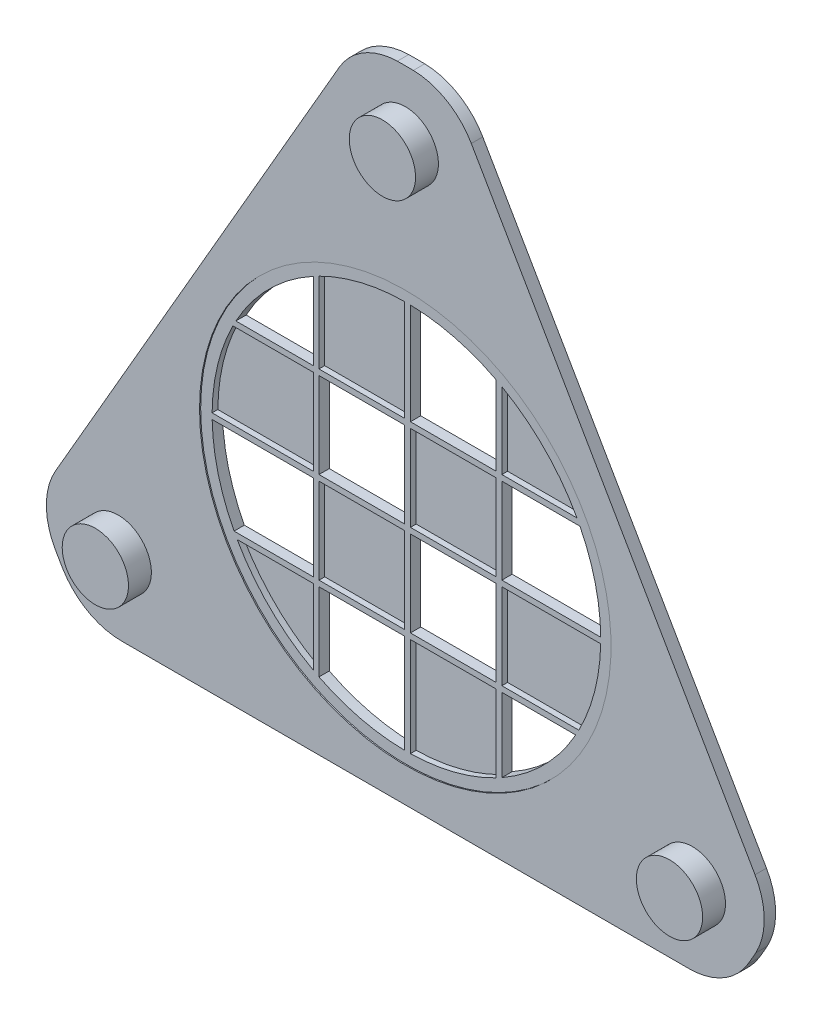
from build123d import *

# Parameters (mm, degrees)
SKETCH2_R               = 18
SKETCH2_W               = 7.5
SKETCH2_H               = 7.5
BOSS_EXTRUDE1_DEPTH     = 0.9
BOSS_EXTRUDE10_START    = 0.4
SKETCH18_W              = 7.7
SKETCH18_H              = 7.7
BOSS_EXTRUDE10_DEPTH    = 0.4
BOSS_EXTRUDE2_START     = -1
SKETCH3_R               = 35
SKETCH3_R_2             = 18
BOSS_EXTRUDE2_DEPTH     = 1
SKETCH4_R               = 2.9
BOSS_EXTRUDE3_DEPTH     = 3
CUT_EXTRUDE1_DEPTH      = 50.588305073
CUT_EXTRUDE1_DEPTH_BACK = 50.588305073
SKETCH7_R               = 59.131365533
FILLET1_R               = 6


with BuildPart() as part:
    # Sketch2 → Boss-Extrude1 (new body)
    with BuildSketch(Plane.XY.offset(10)):
        Circle(SKETCH2_R)
        with BuildLine():
            Line((-8.15, -8.35), (-8.15, -14.91903147))
            ThreePointArc((-8.15, -14.91903147), (-11.939670478, -12.101415986), (-14.808021475, -8.35))
            Line((-14.808021475, -8.35), (-8.15, -8.35))
        make_face(mode=Mode.SUBTRACT)
        with BuildLine():
            Line((-8.15, -7.85), (-15.079041747, -7.85))
            ThreePointArc((-15.079041747, -7.85), (-16.470304718, -4.210589327), (-16.996396677, -0.35))
            Line((-16.996396677, -0.35), (-8.15, -0.35))
            Line((-8.15, -0.35), (-8.15, -7.85))
        make_face(mode=Mode.SUBTRACT)
        with BuildLine():
            Line((-8.15, 0.15), (-16.999338222, 0.15))
            ThreePointArc((-16.999338222, 0.15), (-16.521617742, 4.00451585), (-15.181485435, 7.65))
            Line((-15.181485435, 7.65), (-8.15, 7.65))
            Line((-8.15, 7.65), (-8.15, 0.15))
        make_face(mode=Mode.SUBTRACT)
        with BuildLine():
            Line((-8.15, 8.15), (-14.91903147, 8.15))
            ThreePointArc((-14.91903147, 8.15), (-12.02081528, 12.02081528), (-8.15, 14.91903147))
            Line((-8.15, 14.91903147), (-8.15, 8.15))
        make_face(mode=Mode.SUBTRACT)
        with BuildLine():
            Line((-7.65, 8.15), (-7.65, 15.181485435))
            ThreePointArc((-7.65, 15.181485435), (-4.00451585, 16.521617742), (-0.15, 16.999338222))
            Line((-0.15, 16.999338222), (-0.15, 8.15))
            Line((-0.15, 8.15), (-7.65, 8.15))
        make_face(mode=Mode.SUBTRACT)
        with BuildLine():
            Line((0.35, 8.15), (0.35, 16.996396677))
            ThreePointArc((0.35, 16.996396677), (4.210589327, 16.470304718), (7.85, 15.079041747))
            Line((7.85, 15.079041747), (7.85, 8.15))
            Line((7.85, 8.15), (0.35, 8.15))
        make_face(mode=Mode.SUBTRACT)
        with BuildLine():
            Line((8.35, 8.15), (8.35, 14.808021475))
            ThreePointArc((8.35, 14.808021475), (12.101415986, 11.939670478), (14.91903147, 8.15))
            Line((14.91903147, 8.15), (8.35, 8.15))
        make_face(mode=Mode.SUBTRACT)
        with BuildLine():
            Line((8.35, 7.65), (15.181485435, 7.65))
            ThreePointArc((15.181485435, 7.65), (16.521617742, 4.00451585), (16.999338222, 0.15))
            Line((16.999338222, 0.15), (8.35, 0.15))
            Line((8.35, 0.15), (8.35, 7.65))
        make_face(mode=Mode.SUBTRACT)
        with BuildLine():
            Line((8.35, -0.35), (16.996396677, -0.35))
            ThreePointArc((16.996396677, -0.35), (16.470304718, -4.210589327), (15.079041747, -7.85))
            Line((15.079041747, -7.85), (8.35, -7.85))
            Line((8.35, -7.85), (8.35, -0.35))
        make_face(mode=Mode.SUBTRACT)
        with BuildLine():
            Line((8.35, -8.35), (14.808021475, -8.35))
            ThreePointArc((14.808021475, -8.35), (12.02081528, -12.02081528), (8.35, -14.808021475))
            Line((8.35, -14.808021475), (8.35, -8.35))
        make_face(mode=Mode.SUBTRACT)
        with BuildLine():
            Line((7.85, -8.35), (7.85, -15.079041747))
            ThreePointArc((7.85, -15.079041747), (4.210589327, -16.470304718), (0.35, -16.996396677))
            Line((0.35, -16.996396677), (0.35, -8.35))
            Line((0.35, -8.35), (7.85, -8.35))
        make_face(mode=Mode.SUBTRACT)
        with BuildLine():
            Line((-0.15, -8.35), (-0.15, -16.999338222))
            ThreePointArc((-0.15, -16.999338222), (-4.00451585, -16.521617742), (-7.65, -15.181485435))
            Line((-7.65, -15.181485435), (-7.65, -8.35))
            Line((-7.65, -8.35), (-0.15, -8.35))
        make_face(mode=Mode.SUBTRACT)
        with Locations((-3.9, -4.1)):
            Rectangle(SKETCH2_W, SKETCH2_H, mode=Mode.SUBTRACT)
        with Locations((4.1, -4.1)):
            Rectangle(SKETCH2_W, SKETCH2_H, mode=Mode.SUBTRACT)
        with Locations((-3.9, 3.9)):
            Rectangle(SKETCH2_W, SKETCH2_H, mode=Mode.SUBTRACT)
        with Locations((4.1, 3.9)):
            Rectangle(SKETCH2_W, SKETCH2_H, mode=Mode.SUBTRACT)
    extrude(amount=-BOSS_EXTRUDE1_DEPTH)

    # Sketch18 → Boss-Extrude10 (add)
    with BuildSketch(Plane.XY.offset(9.1).offset(BOSS_EXTRUDE10_START)):
        with BuildLine():
            ThreePointArc((-0.15, 16.999338222), (-4.11362184, 16.494790552), (-7.85, 15.079041747))
            Line((-7.85, 15.079041747), (-7.85, 8.15))
            Line((-7.85, 8.15), (-0.15, 8.15))
            Line((-0.15, 8.15), (-0.15, 16.999338222))
        make_face()
        with Locations((4, 4)):
            Rectangle(SKETCH18_W, SKETCH18_H)
        with Locations((-4, -4)):
            Rectangle(SKETCH18_W, SKETCH18_H)
        with BuildLine():
            Line((8.15, 8.15), (14.91903147, 8.15))
            ThreePointArc((14.91903147, 8.15), (12.02081528, 12.02081528), (8.15, 14.91903147))
            Line((8.15, 14.91903147), (8.15, 8.15))
        make_face()
        with BuildLine():
            ThreePointArc((-15.079041747, 7.85), (-16.494790552, 4.11362184), (-16.999338222, 0.15))
            Line((-16.999338222, 0.15), (-8.15, 0.15))
            Line((-8.15, 0.15), (-8.15, 7.85))
            Line((-8.15, 7.85), (-15.079041747, 7.85))
        make_face()
        with BuildLine():
            Line((0.15, -8.15), (0.15, -16.999338222))
            ThreePointArc((0.15, -16.999338222), (4.11362184, -16.494790552), (7.85, -15.079041747))
            Line((7.85, -15.079041747), (7.85, -8.15))
            Line((7.85, -8.15), (0.15, -8.15))
        make_face()
        with BuildLine():
            ThreePointArc((-14.91903147, -8.15), (-12.02081528, -12.02081528), (-8.15, -14.91903147))
            Line((-8.15, -14.91903147), (-8.15, -8.15))
            Line((-8.15, -8.15), (-14.91903147, -8.15))
        make_face()
        with BuildLine():
            Line((8.15, -7.85), (15.079041747, -7.85))
            ThreePointArc((15.079041747, -7.85), (16.494790552, -4.11362184), (16.999338222, -0.15))
            Line((16.999338222, -0.15), (8.15, -0.15))
            Line((8.15, -0.15), (8.15, -7.85))
        make_face()
    extrude(amount=-BOSS_EXTRUDE10_DEPTH)

    # Sketch3 → Boss-Extrude2 (add)
    with BuildSketch(Plane(origin=(0, 0, 9.1), x_dir=(-1, 0, 0), z_dir=(0, 0, -1)).offset(BOSS_EXTRUDE2_START)):
        Circle(SKETCH3_R)
        Circle(SKETCH3_R_2, mode=Mode.SUBTRACT)
    extrude(amount=BOSS_EXTRUDE2_DEPTH)

    # Sketch4 → Boss-Extrude3 (add)
    with BuildSketch(Plane(origin=(0, 0, 9.1), x_dir=(-1, 0, 0), z_dir=(0, 0, -1))):
        with Locations((0, 29)):
            Circle(SKETCH4_R)
        with Locations((25.11473671, -14.5)):
            Circle(SKETCH4_R)
        with Locations((-25.11473671, -14.5)):
            Circle(SKETCH4_R)
    extrude(amount=-BOSS_EXTRUDE3_DEPTH)

    # Sketch7 → Cut-Extrude1 (cut, two sides: drawn at the far end of the back side and taken through both)
    with BuildSketch(Plane(origin=(0, 0, 9.1), x_dir=(-1, 0, 0), z_dir=(0, 0, -1)).offset(-CUT_EXTRUDE1_DEPTH_BACK)):
        Circle(SKETCH7_R)
        Polygon((0, 42), (-36.373066959, -21), (36.373066959, -21), align=None, mode=Mode.SUBTRACT)
    extrude(amount=CUT_EXTRUDE1_DEPTH + CUT_EXTRUDE1_DEPTH_BACK, mode=Mode.SUBTRACT)

    # Fillet1
    fillet1_edges = [part.edges().sort_by_distance(p)[0] for p in [
        (-4.186533479, 34.748711306, 9.6),
        (-32.186533479, -13.748711306, 9.6),
        (-28, -21, 9.6),
        (28, -21, 9.6),
        (32.186533479, -13.748711306, 9.6),
        (4.186533479, 34.748711306, 9.6),
    ]]
    fillet(fillet1_edges, radius=FILLET1_R)


solid = part.part
